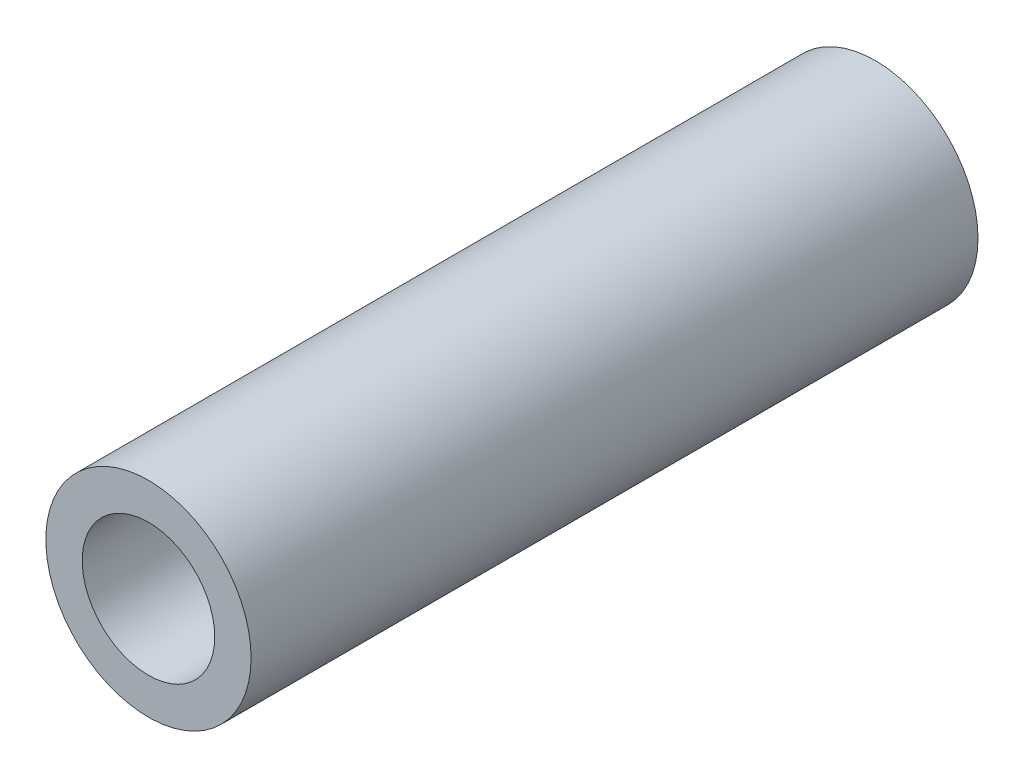
from build123d import *

# Parameters (mm, degrees)
SKETCH1_R           = 2.4
SKETCH1_R_2         = 1.55
BOSS_EXTRUDE1_DEPTH = 17


with BuildPart() as part:
    # Sketch1 → Boss-Extrude1 (new body)
    with BuildSketch(Plane.XY):
        Circle(SKETCH1_R)
        Circle(SKETCH1_R_2, mode=Mode.SUBTRACT)
    extrude(amount=BOSS_EXTRUDE1_DEPTH)


solid = part.part
